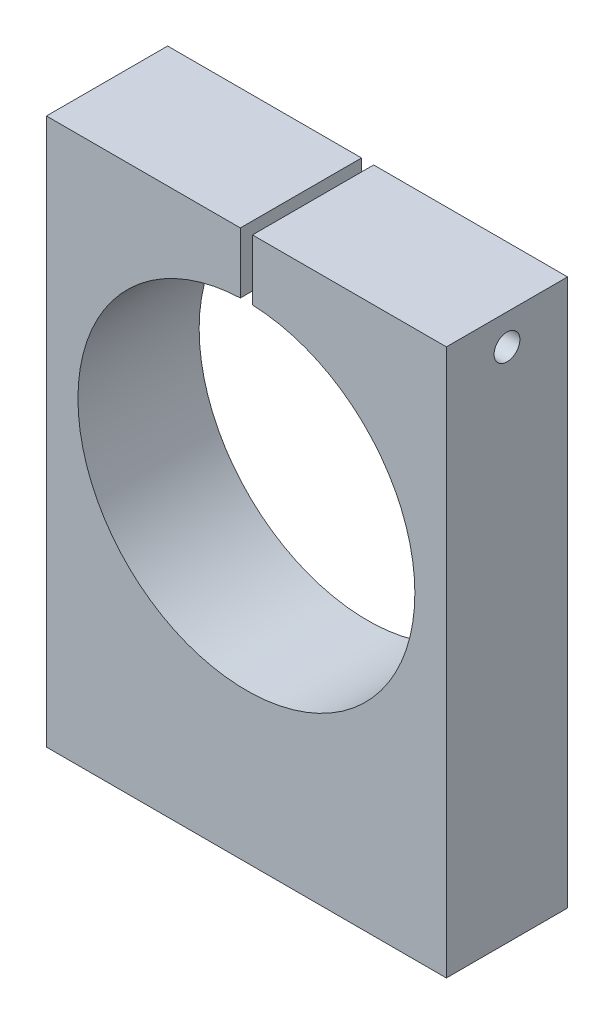
from build123d import *

# Parameters (mm, degrees)
SKETCH1_W                 = 41.91
SKETCH1_H                 = 57.277
SKETCH1_R                 = 17.653
BOSS_EXTRUDE1_DEPTH       = 6.35
CUT_EXTRUDE1_REACH        = 63.32
CUT_EXTRUDE1_END_RADIUS   = 17.653
SKETCH4_W                 = 1.27
SKETCH4_H                 = 12.7
SKETCH9_R                 = 1.7859375
CUT_EXTRUDE2_DEPTH        = 20.32
F_6_32_TAPPED_HOLE1_D     = 2.7051
F_4_40_TAPPED_HOLE3_D     = 2.2606
F_4_40_TAPPED_HOLE3_DEPTH = 12.7
F_4_40_TAPPED_HOLE3_TIP   = 0.679152758


with BuildPart() as part:
    # Sketch1 → Boss-Extrude1 (new, symmetric)
    with BuildSketch(Plane.XY):
        with Locations((0, 28.6385)):
            Rectangle(SKETCH1_W, SKETCH1_H)
        with Locations((0, 33.274)):
            Circle(SKETCH1_R, mode=Mode.SUBTRACT)
    extrude(amount=BOSS_EXTRUDE1_DEPTH, both=True)

    # Cut-Extrude1: up to this cylinder (the profile starts outside it)
    cut_extrude1_end = Plane(origin=(0, 33.274, 0), z_dir=(0, 0, -1)) * Cylinder(CUT_EXTRUDE1_END_RADIUS, 162.946, mode=Mode.PRIVATE)
    # Sketch4 → Cut-Extrude1 (cut, up to the surface)
    with BuildSketch(Plane(origin=(0, 57.277, 0), x_dir=(1, 0, 0), z_dir=(0, 1, 0)), mode=Mode.PRIVATE) as cut_extrude1_sk1:
        Rectangle(SKETCH4_W, SKETCH4_H)
    cut_extrude1_tool1 = extrude(cut_extrude1_sk1.sketch, amount=-CUT_EXTRUDE1_REACH, mode=Mode.PRIVATE) - cut_extrude1_end
    add(cut_extrude1_tool1.solids().sort_by_distance((0, 57.277, 0))[0], mode=Mode.SUBTRACT)

    # Sketch9 → Cut-Extrude2 (cut)
    with BuildSketch(Plane.ZY.offset(20.955)):
        with Locations(Location((0, 54.09628772, 0), (0, 0, 270))):
            Circle(SKETCH9_R)
    extrude(amount=-CUT_EXTRUDE2_DEPTH, mode=Mode.SUBTRACT)

    # #6-32 Tapped Hole1 (through all)
    with Locations(Plane.ZY.offset(-0.635)):
        with Locations((0, 54.09628772)):
            Hole(F_6_32_TAPPED_HOLE1_D / 2)

    # #4-40 Tapped Hole3
    with Locations(Plane.XZ):
        with Locations((-14.605, 0), (14.605, 0)):
            Hole(F_4_40_TAPPED_HOLE3_D / 2, depth=F_4_40_TAPPED_HOLE3_DEPTH)
            with Locations((0, 0, -(F_4_40_TAPPED_HOLE3_DEPTH + F_4_40_TAPPED_HOLE3_TIP / 2))):  # 118° drill point
                Cone(0, F_4_40_TAPPED_HOLE3_D / 2, F_4_40_TAPPED_HOLE3_TIP, mode=Mode.SUBTRACT)


solid = part.part
